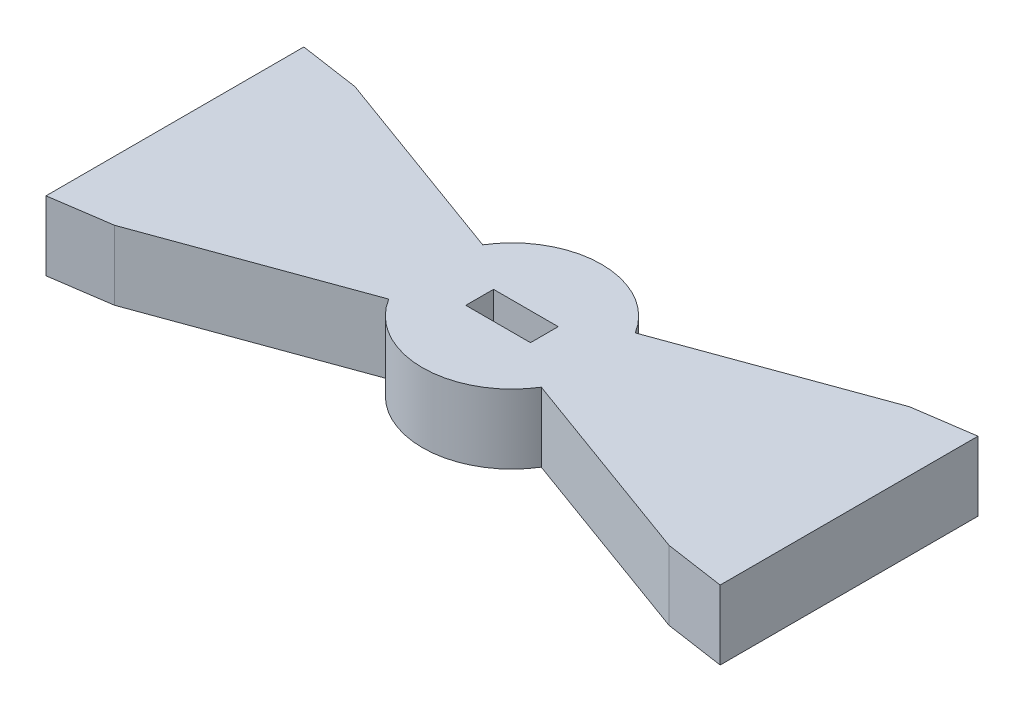
from build123d import *

# Parameters (mm, degrees)
BOSS_EXTRUDE3_DEPTH = 1.905
SKETCH2_W           = 1.778
SKETCH2_H           = 0.762
CUT_EXTRUDE1_DEPTH  = 2.54


with BuildPart() as part:
    # Sketch1 → Boss-Extrude3 (new body)
    with BuildSketch(Plane(origin=(0, 0, 0), x_dir=(1, 0, 0), z_dir=(0, 1, 0))):
        with BuildLine():
            Line((9.2654018, 3.543697889), (9.2654018, -3.543697889))
            Line((9.2654018, -3.543697889), (7.62, -3.302))
            Line((7.62, -3.302), (2.096490205, -1.291606846))
            ThreePointArc((2.096490205, -1.291606846), (0, -2.462421456), (-2.096490205, -1.291606846))
            Line((-2.096490205, -1.291606846), (-7.62, -3.302))
            Line((-7.62, -3.302), (-9.2654018, -3.543697889))
            Line((-9.2654018, -3.543697889), (-9.2654018, 3.543697889))
            Line((-9.2654018, 3.543697889), (-7.62, 3.302))
            Line((-7.62, 3.302), (-2.096490205, 1.291606846))
            ThreePointArc((-2.096490205, 1.291606846), (0, 2.462421456), (2.096490205, 1.291606846))
            Line((2.096490205, 1.291606846), (7.62, 3.302))
            Line((7.62, 3.302), (9.2654018, 3.543697889))
        make_face()
    extrude(amount=BOSS_EXTRUDE3_DEPTH)

    # Sketch2 → Cut-Extrude1 (cut)
    with BuildSketch(Plane(origin=(0, 1.905, 0), x_dir=(1, 0, 0), z_dir=(0, 1, 0))):
        Rectangle(SKETCH2_W, SKETCH2_H)
    extrude(amount=-CUT_EXTRUDE1_DEPTH, mode=Mode.SUBTRACT)


solid = part.part
